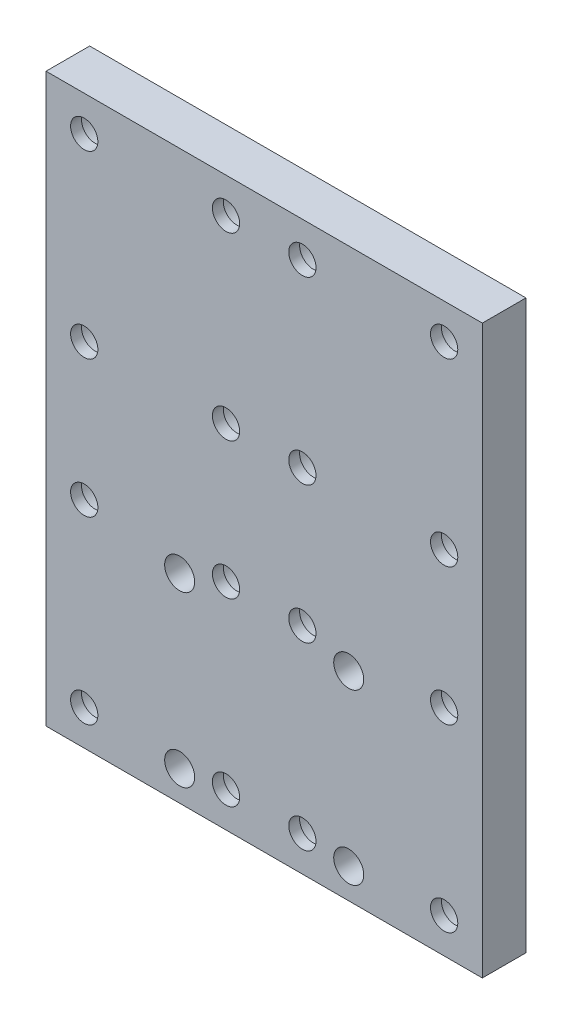
from build123d import *

# Parameters (mm, degrees)
SKETCH1_W           = 80
SKETCH1_H           = 104
BOSS_EXTRUDE1_DEPTH = 8
SKETCH2_R           = 2.5
CUT_EXTRUDE1_DEPTH  = 8
SKETCH4_R           = 4.25
CUT_EXTRUDE3_DEPTH  = 6
SKETCH5_R           = 1.5
CUT_EXTRUDE4_DEPTH  = 67.090846567
SKETCH6_R           = 2.75
CUT_EXTRUDE5_DEPTH  = 4


with BuildPart() as part:
    # Sketch1 → Boss-Extrude1 (new body)
    with BuildSketch(Plane.XY):
        Rectangle(SKETCH1_W, SKETCH1_H)
    extrude(amount=BOSS_EXTRUDE1_DEPTH)

    # Sketch2 → Cut-Extrude1 (cut)
    with BuildSketch(Plane.XY.offset(8)):
        with Locations((-33, 45.55)):
            Circle(SKETCH2_R)
        with Locations((-7, 45.55)):
            Circle(SKETCH2_R)
        with Locations((-7, 12.55)):
            Circle(SKETCH2_R)
        with Locations((-33, 12.55)):
            Circle(SKETCH2_R)
        with Locations((33, 45.55)):
            Circle(SKETCH2_R)
        with Locations((7, 45.55)):
            Circle(SKETCH2_R)
        with Locations((7, 12.55)):
            Circle(SKETCH2_R)
        with Locations((33, 12.55)):
            Circle(SKETCH2_R)
        with Locations((33, -12.55)):
            Circle(SKETCH2_R)
        with Locations((7, -12.55)):
            Circle(SKETCH2_R)
        with Locations((33, -45.55)):
            Circle(SKETCH2_R)
        with Locations((7, -45.55)):
            Circle(SKETCH2_R)
        with Locations((-7, -45.55)):
            Circle(SKETCH2_R)
        with Locations((-7, -12.55)):
            Circle(SKETCH2_R)
        with Locations((-33, -12.55)):
            Circle(SKETCH2_R)
        with Locations((-33, -45.55)):
            Circle(SKETCH2_R)
    extrude(amount=-CUT_EXTRUDE1_DEPTH, mode=Mode.SUBTRACT)

    # Sketch4 → Cut-Extrude3 (cut)
    with BuildSketch(Plane(origin=(0, 0, 0), x_dir=(-1, 0, 0), z_dir=(0, 0, -1))):
        with Locations((-33, 45.55)):
            Circle(SKETCH4_R)
        with Locations((-7, 45.55)):
            Circle(SKETCH4_R)
        with Locations((-7, 12.55)):
            Circle(SKETCH4_R)
        with Locations((-33, 12.55)):
            Circle(SKETCH4_R)
        with Locations((-33, -12.55)):
            Circle(SKETCH4_R)
        with Locations((-7, -12.55)):
            Circle(SKETCH4_R)
        with Locations((-7, -45.55)):
            Circle(SKETCH4_R)
        with Locations((-33, -45.55)):
            Circle(SKETCH4_R)
        with Locations((7, -45.55)):
            Circle(SKETCH4_R)
        with Locations((33, -45.55)):
            Circle(SKETCH4_R)
        with Locations((7, -12.55)):
            Circle(SKETCH4_R)
        with Locations((33, -12.55)):
            Circle(SKETCH4_R)
        with Locations((7, 12.55)):
            Circle(SKETCH4_R)
        with Locations((33, 12.55)):
            Circle(SKETCH4_R)
        with Locations((7, 45.55)):
            Circle(SKETCH4_R)
        with Locations((33, 45.55)):
            Circle(SKETCH4_R)
    extrude(amount=-CUT_EXTRUDE3_DEPTH, mode=Mode.SUBTRACT)

    # Sketch5 → Cut-Extrude4 (cut, through all)
    with BuildSketch(Plane(origin=(0, 0, 0), x_dir=(-1, 0, 0), z_dir=(0, 0, -1))):
        with Locations((15.5, -15.5)):
            Circle(SKETCH5_R)
        with Locations((-15.5, -15.5)):
            Circle(SKETCH5_R)
        with Locations((-15.5, -46.5)):
            Circle(SKETCH5_R)
        with Locations((15.5, -46.5)):
            Circle(SKETCH5_R)
    extrude(amount=-CUT_EXTRUDE4_DEPTH, mode=Mode.SUBTRACT)

    # Sketch6 → Cut-Extrude5 (cut)
    with BuildSketch(Plane.XY.offset(8)):
        with Locations((15.5, -15.5)):
            Circle(SKETCH6_R)
        with Locations((-15.5, -15.5)):
            Circle(SKETCH6_R)
        with Locations((15.5, -46.5)):
            Circle(SKETCH6_R)
        with Locations((-15.5, -46.5)):
            Circle(SKETCH6_R)
    extrude(amount=-CUT_EXTRUDE5_DEPTH, mode=Mode.SUBTRACT)


solid = part.part
